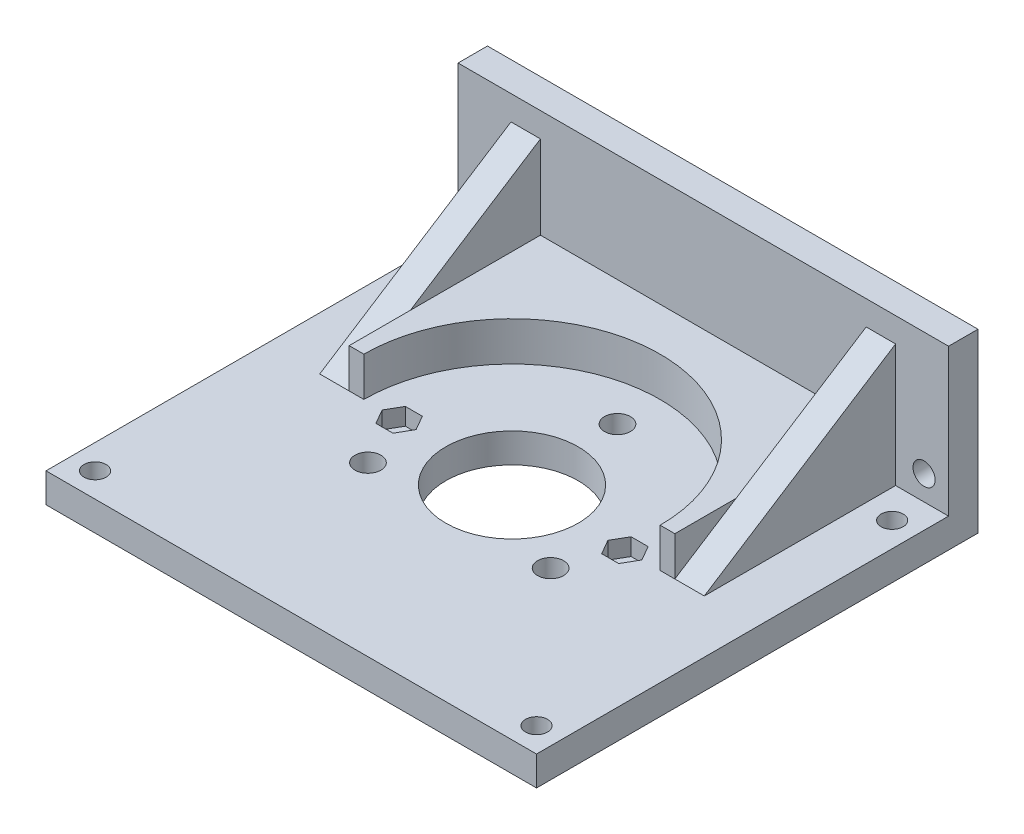
from build123d import *

# Parameters (mm, degrees)
SKETCH1_W           = 100
SKETCH1_H           = 90
SKETCH1_R           = 13.5
SKETCH1_R_2         = 2.65
SKETCH1_R_3         = 1.65
SKETCH1_R_4         = 2.25
BOSS_EXTRUDE1_DEPTH = 6
BOSS_EXTRUDE2_DEPTH = 8
SKETCH3_W           = 100
SKETCH3_H           = 6
BOSS_EXTRUDE3_DEPTH = 30
CUT_EXTRUDE1_REACH  = 106.173
SKETCH7_R           = 2.25
CUT_EXTRUDE2_DEPTH  = 3.5
BOSS_EXTRUDE4_DEPTH = 6


with BuildPart() as part:
    # Sketch1 → Boss-Extrude1 (new body)
    with BuildSketch(Plane(origin=(0, 0, 0), x_dir=(1, 0, 0), z_dir=(0, 1, 0))):
        Rectangle(SKETCH1_W, SKETCH1_H)
        with Locations(Location((0, 0, 0), (0, 0, 270))):
            Circle(SKETCH1_R, mode=Mode.SUBTRACT)
        with Locations(Location((0, 21.5, 0), (0, 0, 270))):
            Circle(SKETCH1_R_2, mode=Mode.SUBTRACT)
        with Locations(Location((23.0125, 0, 0), (0, 0, 270))):
            Circle(SKETCH1_R_3, mode=Mode.SUBTRACT)
        with Locations(Location((-23.0125, 0, 0), (0, 0, 270))):
            Circle(SKETCH1_R_3, mode=Mode.SUBTRACT)
        with Locations(Location((18.619546181, -10.75, 0), (0, 0, 270))):
            Circle(SKETCH1_R_2, mode=Mode.SUBTRACT)
        with Locations(Location((-18.619546181, -10.75, 0), (0, 0, 270))):
            Circle(SKETCH1_R_2, mode=Mode.SUBTRACT)
        with Locations(Location((-45, -40, 0), (0, 0, 270))):
            Circle(SKETCH1_R_4, mode=Mode.SUBTRACT)
        with Locations(Location((-45, 32.5, 0), (0, 0, 270))):
            Circle(SKETCH1_R_4, mode=Mode.SUBTRACT)
        with Locations(Location((45, 32.5, 0), (0, 0, 90))):
            Circle(SKETCH1_R_4, mode=Mode.SUBTRACT)
        with Locations(Location((45, -40, 0), (0, 0, 90))):
            Circle(SKETCH1_R_4, mode=Mode.SUBTRACT)
    extrude(amount=BOSS_EXTRUDE1_DEPTH)

    # Sketch2 → Boss-Extrude2 (add)
    with BuildSketch(Plane(origin=(0, 6, 0), x_dir=(1, 0, 0), z_dir=(0, 1, 0))):
        with BuildLine():
            Line((-30.2, 0), (-33.2, 0))
            Line((-33.2, 0), (-33.2, 39))
            Line((-33.2, 39), (33.2, 39))
            Line((33.2, 39), (33.2, 0))
            Line((33.2, 0), (30.2, 0))
            ThreePointArc((30.2, 0), (0, 30.2), (-30.2, 0))
        make_face()
    extrude(amount=BOSS_EXTRUDE2_DEPTH)

    # Sketch3 → Boss-Extrude3 (add)
    with BuildSketch(Plane(origin=(0, 6, 0), x_dir=(1, 0, 0), z_dir=(0, 1, 0))):
        with Locations((0, 42)):
            Rectangle(SKETCH3_W, SKETCH3_H)
    extrude(amount=BOSS_EXTRUDE3_DEPTH)

    # Sketch7 → Cut-Extrude1 (cut, up to next)
    with BuildSketch(Plane.XY.offset(-39), mode=Mode.PRIVATE) as cut_extrude1_sk1:
        with Locations((-45, 11)):
            Circle(SKETCH7_R)
    cut_extrude1_tool1 = extrude(cut_extrude1_sk1.sketch, amount=-CUT_EXTRUDE1_REACH, mode=Mode.PRIVATE) & part.part
    # Sketch7 → Cut-Extrude1 (cut, up to next)
    with BuildSketch(Plane.XY.offset(-39), mode=Mode.PRIVATE) as cut_extrude1_sk2:
        with Locations((45, 11)):
            Circle(SKETCH7_R)
    cut_extrude1_tool2 = extrude(cut_extrude1_sk2.sketch, amount=-CUT_EXTRUDE1_REACH, mode=Mode.PRIVATE) & part.part
    add(cut_extrude1_tool1.solids().sort_by_distance((-45, 11, -39))[0], mode=Mode.SUBTRACT)
    add(cut_extrude1_tool2.solids().sort_by_distance((45, 11, -39))[0], mode=Mode.SUBTRACT)

    # Sketch8 → Cut-Extrude2 (cut)
    with BuildSketch(Plane(origin=(0, 6, 0), x_dir=(1, 0, 0), z_dir=(0, 1, 0))):
        Polygon((19.548398385, 0), (21.280449192, -3), (24.744550808, -3), (26.476601615, 0), (24.744550808, 3), (21.280449192, 3), align=None)
        Polygon((-19.548398385, 0), (-21.280449192, 3), (-24.744550808, 3), (-26.476601615, 0), (-24.744550808, -3), (-21.280449192, -3), align=None)
    extrude(amount=-CUT_EXTRUDE2_DEPTH, mode=Mode.SUBTRACT)

    # Sketch9 → Boss-Extrude4 (add)
    with BuildSketch(Plane.ZY.offset(33.2)):
        Polygon((-39, 6), (-39, 31), (0, 6), align=None)
    boss_extrude4 = extrude(amount=BOSS_EXTRUDE4_DEPTH)

    # Mirror1: Boss-Extrude4 across plane
    add(boss_extrude4.mirror(Plane(origin=(0, 0, 0), x_dir=(0, 0, 1), z_dir=(1, 0, 0))))


solid = part.part
